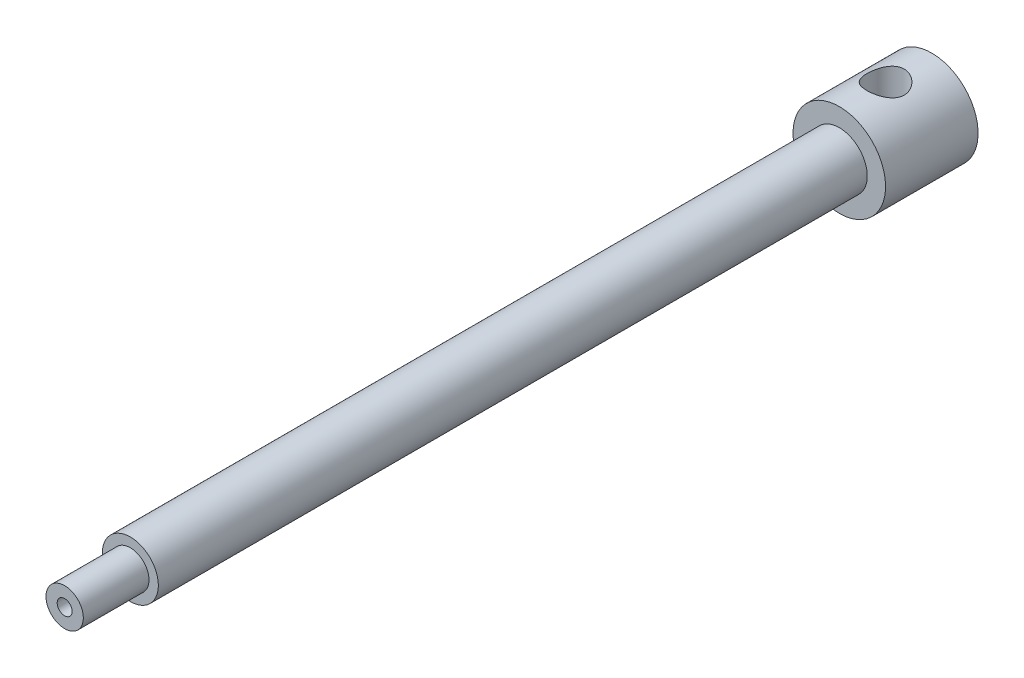
from build123d import *

# Parameters (mm, degrees)
CUT_EXTRUDE1_DEPTH      = 83.029585714
CUT_EXTRUDE1_DEPTH_BACK = 83.029585714
SKETCH2_R               = 3.175


with BuildPart() as part:
    # Sketch1 → Revolve1 (revolve)
    with BuildSketch(Plane(origin=(0, 0, 0), x_dir=(1, 0, 0), z_dir=(0, 1, 0))):
        Polygon((0, 81.270247818), (-7.874, 81.270247818), (-7.874, 65.522247818), (-4.7625, 65.522247818), (-4.7625, -55.127752182), (-3.175, -55.127752182), (-3.175, -66.303752182), (-1.27, -66.303752182), (-1.27, -57.942062416), (0, -57.942062416), align=None)
    revolve(axis=Axis((0, 0, -59.310994764), (0, 0, 1)))

    # Sketch2 → Cut-Extrude1 (cut, two sides: drawn at the far end of the back side and taken through both)
    with BuildSketch(Plane(origin=(0, 0, 0), x_dir=(1, 0, 0), z_dir=(0, 1, 0)).offset(-CUT_EXTRUDE1_DEPTH_BACK)):
        with Locations(Location((0, 73.396247818, 0), (0, 0, 270))):
            Circle(SKETCH2_R)
    extrude(amount=CUT_EXTRUDE1_DEPTH + CUT_EXTRUDE1_DEPTH_BACK, mode=Mode.SUBTRACT)


solid = part.part
